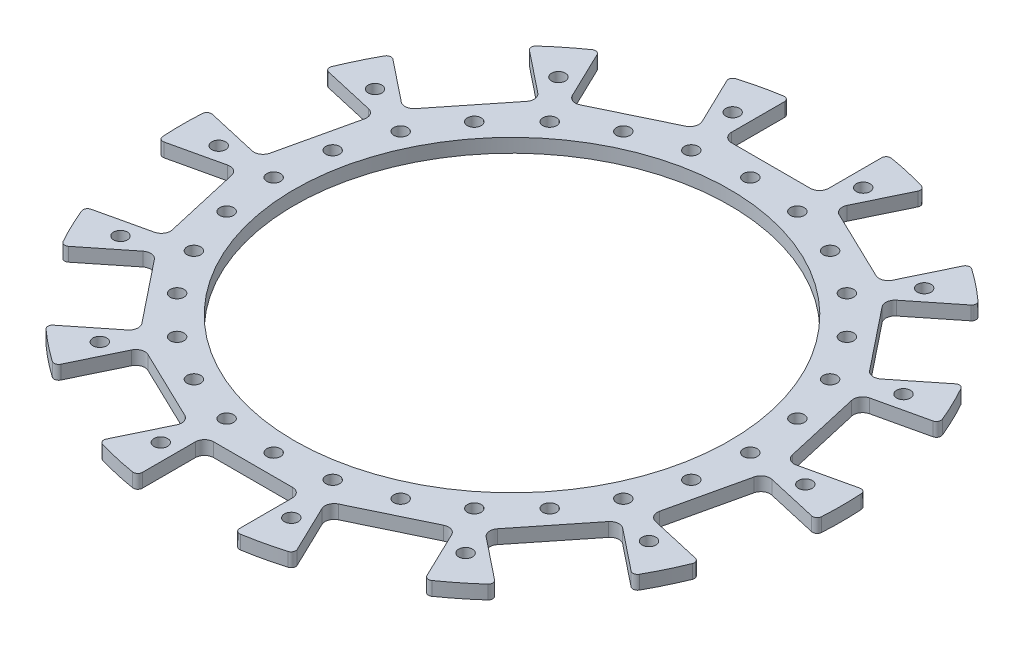
from build123d import *

# Parameters (mm, degrees)
EXTRUDE_1_DEPTH     = 3
FILLET_1_R          = 2
FILLET_2_R          = 1
SKETCH_2_R          = 1.5
CUT_EXTRUDE_1_DEPTH = 11
SKETCH_3_R          = 52.5
SKETCH_3_R_2        = 28
SKETCH_3_R_3        = 9
CUT_EXTRUDE_2_DEPTH = 11
EXTRUDE_START       = -3
SKETCH_9_R          = 52.5
SKETCH_9_R_2        = 47.5
EXTRUDE_2_DEPTH     = 3
SKETCH_10_R         = 1.5
CUT_EXTRUDE_3_DEPTH = 3


with BuildPart() as part:
    # 草图1 → 凸台-拉伸1 (new body)
    with BuildSketch(Plane(origin=(0, 0, 0), x_dir=(1, 0, 0), z_dir=(0, 1, 0))):
        with BuildLine():
            Line((-10.6, -71.215447762), (-10.6, -56.5))
            Line((-10.6, -56.5), (10.6, -56.5))
            Line((10.6, -56.5), (10.6, -71.215447762))
            ThreePointArc((10.6, -71.215447762), (16.021507245, -70.194809677), (21.348954758, -68.762068982))
            Line((21.348954758, -68.762068982), (14.96416126, -55.503908671))
            Line((14.96416126, -55.503908671), (34.06470126, -46.305573402))
            Line((34.06470126, -46.305573402), (40.449494758, -59.563733713))
            ThreePointArc((40.449494758, -59.563733713), (44.891265734, -56.291866738), (49.069487199, -52.689519129))
            Line((49.069487199, -52.689519129), (37.56448686, -43.514587519))
            Line((37.56448686, -43.514587519), (50.782470659, -26.939760091))
            Line((50.782470659, -26.939760091), (62.287470998, -36.114691701))
            ThreePointArc((62.287470998, -36.114691701), (64.869758489, -31.239629216), (67.071205902, -26.181163817))
            Line((67.071205902, -26.181163817), (52.724705138, -22.906668638))
            Line((52.724705138, -22.906668638), (57.442148938, -2.238196899))
            Line((57.442148938, -2.238196899), (71.788649702, -5.512692079))
            ThreePointArc((71.788649702, -5.512692079), (72, 0), (71.788649702, 5.512692079))
            Line((71.788649702, 5.512692079), (57.442148938, 2.238196899))
            Line((57.442148938, 2.238196899), (52.724705138, 22.906668638))
            Line((52.724705138, 22.906668638), (67.071205902, 26.181163817))
            ThreePointArc((67.071205902, 26.181163817), (64.869758489, 31.239629216), (62.287470998, 36.114691701))
            Line((62.287470998, 36.114691701), (50.782470659, 26.939760091))
            Line((50.782470659, 26.939760091), (37.56448686, 43.514587519))
            Line((37.56448686, 43.514587519), (49.069487199, 52.689519129))
            ThreePointArc((49.069487199, 52.689519129), (44.891265734, 56.291866738), (40.449494758, 59.563733713))
            Line((40.449494758, 59.563733713), (34.06470126, 46.305573402))
            Line((34.06470126, 46.305573402), (14.96416126, 55.503908671))
            Line((14.96416126, 55.503908671), (21.348954758, 68.762068982))
            ThreePointArc((21.348954758, 68.762068982), (16.021507245, 70.194809677), (10.6, 71.215447762))
            Line((10.6, 71.215447762), (10.6, 56.5))
            Line((10.6, 56.5), (-10.6, 56.5))
            Line((-10.6, 56.5), (-10.6, 71.215447762))
            ThreePointArc((-10.6, 71.215447762), (-16.021507245, 70.194809677), (-21.348954758, 68.762068982))
            Line((-21.348954758, 68.762068982), (-14.96416126, 55.503908671))
            Line((-14.96416126, 55.503908671), (-34.06470126, 46.305573402))
            Line((-34.06470126, 46.305573402), (-40.449494758, 59.563733713))
            ThreePointArc((-40.449494758, 59.563733713), (-44.891265734, 56.291866738), (-49.069487199, 52.689519129))
            Line((-49.069487199, 52.689519129), (-37.56448686, 43.514587519))
            Line((-37.56448686, 43.514587519), (-50.782470659, 26.939760091))
            Line((-50.782470659, 26.939760091), (-62.287470998, 36.114691701))
            ThreePointArc((-62.287470998, 36.114691701), (-64.869758489, 31.239629216), (-67.071205902, 26.181163817))
            Line((-67.071205902, 26.181163817), (-52.724705138, 22.906668638))
            Line((-52.724705138, 22.906668638), (-57.442148938, 2.238196899))
            Line((-57.442148938, 2.238196899), (-71.788649702, 5.512692079))
            ThreePointArc((-71.788649702, 5.512692079), (-72, 0), (-71.788649702, -5.512692079))
            Line((-71.788649702, -5.512692079), (-57.442148938, -2.238196899))
            Line((-57.442148938, -2.238196899), (-52.724705138, -22.906668638))
            Line((-52.724705138, -22.906668638), (-67.071205902, -26.181163817))
            ThreePointArc((-67.071205902, -26.181163817), (-64.869758489, -31.239629216), (-62.287470998, -36.114691701))
            Line((-62.287470998, -36.114691701), (-50.782470659, -26.939760091))
            Line((-50.782470659, -26.939760091), (-37.56448686, -43.514587519))
            Line((-37.56448686, -43.514587519), (-49.069487199, -52.689519129))
            ThreePointArc((-49.069487199, -52.689519129), (-44.891265734, -56.291866738), (-40.449494758, -59.563733713))
            Line((-40.449494758, -59.563733713), (-34.06470126, -46.305573402))
            Line((-34.06470126, -46.305573402), (-14.96416126, -55.503908671))
            Line((-14.96416126, -55.503908671), (-21.348954758, -68.762068982))
            ThreePointArc((-21.348954758, -68.762068982), (-16.021507245, -70.194809677), (-10.6, -71.215447762))
        make_face()
    extrude(amount=EXTRUDE_1_DEPTH)

    # 圆角1
    fillet_1_edges = [part.edges().sort_by_distance(p)[0] for p in [
        (10.6, 1.5, 56.5),
        (-10.6, 1.5, 56.5),
        (-14.96416126, 1.5, 55.503908671),
        (-34.06470126, 1.5, 46.305573402),
        (-37.56448686, 1.5, 43.514587519),
        (-50.782470659, 1.5, 26.939760091),
        (-52.724705138, 1.5, 22.906668638),
        (-57.442148938, 1.5, 2.238196899),
        (-57.442148938, 1.5, -2.238196899),
        (-52.724705138, 1.5, -22.906668638),
        (-50.782470659, 1.5, -26.939760091),
        (-37.56448686, 1.5, -43.514587519),
        (-34.06470126, 1.5, -46.305573402),
        (-14.96416126, 1.5, -55.503908671),
        (-10.6, 1.5, -56.5),
        (10.6, 1.5, -56.5),
        (14.96416126, 1.5, -55.503908671),
        (34.06470126, 1.5, -46.305573402),
        (37.56448686, 1.5, -43.514587519),
        (50.782470659, 1.5, -26.939760091),
        (52.724705138, 1.5, -22.906668638),
        (57.442148938, 1.5, -2.238196899),
        (57.442148938, 1.5, 2.238196899),
        (52.724705138, 1.5, 22.906668638),
        (50.782470659, 1.5, 26.939760091),
        (37.56448686, 1.5, 43.514587519),
        (34.06470126, 1.5, 46.305573402),
        (14.96416126, 1.5, 55.503908671),
    ]]
    fillet(fillet_1_edges, radius=FILLET_1_R)

    # 圆角2
    fillet_2_edges = [part.edges().sort_by_distance(p)[0] for p in [
        (21.348954758, 1.5, 68.762068982),
        (10.6, 1.5, 71.215447762),
        (-10.6, 1.5, 71.215447762),
        (-21.348954758, 1.5, 68.762068982),
        (-40.449494758, 1.5, 59.563733713),
        (-49.069487199, 1.5, 52.689519129),
        (-62.287470998, 1.5, 36.114691701),
        (-67.071205902, 1.5, 26.181163817),
        (-71.788649702, 1.5, 5.512692079),
        (-71.788649702, 1.5, -5.512692079),
        (-67.071205902, 1.5, -26.181163817),
        (-62.287470998, 1.5, -36.114691701),
        (-49.069487199, 1.5, -52.689519129),
        (-40.449494758, 1.5, -59.563733713),
        (-21.348954758, 1.5, -68.762068982),
        (-10.6, 1.5, -71.215447762),
        (10.6, 1.5, -71.215447762),
        (21.348954758, 1.5, -68.762068982),
        (40.449494758, 1.5, -59.563733713),
        (49.069487199, 1.5, -52.689519129),
        (62.287470998, 1.5, -36.114691701),
        (67.071205902, 1.5, -26.181163817),
        (71.788649702, 1.5, -5.512692079),
        (71.788649702, 1.5, 5.512692079),
        (67.071205902, 1.5, 26.181163817),
        (62.287470998, 1.5, 36.114691701),
        (49.069487199, 1.5, 52.689519129),
        (40.449494758, 1.5, 59.563733713),
    ]]
    fillet(fillet_2_edges, radius=FILLET_2_R)

    # 草图2 → 切除-拉伸1 (cut)
    with BuildSketch(Plane(origin=(0, 0, 0), x_dir=(1, 0, 0), z_dir=(0, 1, 0))):
        with Locations(Location((64, 0, 0), (0, 0, 270))):
            Circle(SKETCH_2_R)
        with Locations(Location((57.662007546, -27.768559304, 0), (0, 0, 270))):
            Circle(SKETCH_2_R)
        with Locations(Location((39.903347319, -50.037214878, 0), (0, 0, 270))):
            Circle(SKETCH_2_R)
        with Locations(Location((14.241339773, -62.39538638, 0), (0, 0, 270))):
            Circle(SKETCH_2_R)
        with Locations(Location((-14.241339773, -62.39538638, 0), (0, 0, 270))):
            Circle(SKETCH_2_R)
        with Locations(Location((-39.903347319, -50.037214878, 0), (0, 0, 270))):
            Circle(SKETCH_2_R)
        with Locations(Location((-57.662007546, -27.768559304, 0), (0, 0, 270))):
            Circle(SKETCH_2_R)
        with Locations(Location((-64, 0, 0), (0, 0, 270))):
            Circle(SKETCH_2_R)
        with Locations(Location((-57.662007546, 27.768559304, 0), (0, 0, 270))):
            Circle(SKETCH_2_R)
        with Locations(Location((-39.903347319, 50.037214878, 0), (0, 0, 270))):
            Circle(SKETCH_2_R)
        with Locations(Location((-14.241339773, 62.39538638, 0), (0, 0, 270))):
            Circle(SKETCH_2_R)
        with Locations(Location((14.241339773, 62.39538638, 0), (0, 0, 270))):
            Circle(SKETCH_2_R)
        with Locations(Location((39.903347319, 50.037214878, 0), (0, 0, 270))):
            Circle(SKETCH_2_R)
        with Locations(Location((57.662007546, 27.768559304, 0), (0, 0, 270))):
            Circle(SKETCH_2_R)
    extrude(amount=CUT_EXTRUDE_1_DEPTH, mode=Mode.SUBTRACT)

    # 草图3 → 切除-拉伸2 (cut)
    # profile 1 of 3: a face of its own
    with BuildSketch(Plane(origin=(0, 0, 0), x_dir=(1, 0, 0), z_dir=(0, 1, 0))):
        with Locations(Location((0, 0, 0), (0, 0, 270))):
            Circle(SKETCH_3_R)
        Circle(SKETCH_3_R_2, mode=Mode.SUBTRACT)
    # profile 2 of 3: a face of its own
    with BuildSketch(Plane(origin=(0, 0, 0), x_dir=(1, 0, 0), z_dir=(0, 1, 0))):
        Circle(SKETCH_3_R_2)
        Circle(SKETCH_3_R_3, mode=Mode.SUBTRACT)
    # profile 3 of 3: a face of its own
    with BuildSketch(Plane(origin=(0, 0, 0), x_dir=(1, 0, 0), z_dir=(0, 1, 0))):
        Circle(SKETCH_3_R_3)
    extrude(amount=CUT_EXTRUDE_2_DEPTH, mode=Mode.SUBTRACT)

    # 草图9 → 凸台-拉伸2 (add)
    with BuildSketch(Plane(origin=(0, 3, 0), x_dir=(1, 0, 0), z_dir=(0, 1, 0)).offset(EXTRUDE_START)):
        Circle(SKETCH_9_R)
        with Locations(Location((0, 0, 0), (0, 0, 270))):
            Circle(SKETCH_9_R_2, mode=Mode.SUBTRACT)
    extrude(amount=EXTRUDE_2_DEPTH)

    # 草图10 → 切除-拉伸3 (cut)
    with BuildSketch(Plane(origin=(0, 3, 0), x_dir=(1, 0, 0), z_dir=(0, 1, 0))):
        with Locations(Location((0, 52, 0), (0, 0, 270))):
            Circle(SKETCH_10_R)
        with Locations(Location((11.571088566, 50.696251433, 0), (0, 0, 270))):
            Circle(SKETCH_10_R)
        with Locations(Location((22.561954434, 46.850381131, 0), (0, 0, 270))):
            Circle(SKETCH_10_R)
        with Locations(Location((32.421469697, 40.655237088, 0), (0, 0, 270))):
            Circle(SKETCH_10_R)
        with Locations(Location((40.655237088, 32.421469697, 0), (0, 0, 270))):
            Circle(SKETCH_10_R)
        with Locations(Location((46.850381131, 22.561954434, 0), (0, 0, 270))):
            Circle(SKETCH_10_R)
        with Locations(Location((50.696251433, 11.571088566, 0), (0, 0, 270))):
            Circle(SKETCH_10_R)
        with Locations(Location((52, 0, 0), (0, 0, 270))):
            Circle(SKETCH_10_R)
        with Locations(Location((50.696251433, -11.571088566, 0), (0, 0, 270))):
            Circle(SKETCH_10_R)
        with Locations(Location((46.850381131, -22.561954434, 0), (0, 0, 270))):
            Circle(SKETCH_10_R)
        with Locations(Location((40.655237088, -32.421469697, 0), (0, 0, 270))):
            Circle(SKETCH_10_R)
        with Locations(Location((32.421469697, -40.655237088, 0), (0, 0, 270))):
            Circle(SKETCH_10_R)
        with Locations(Location((22.561954434, -46.850381131, 0), (0, 0, 270))):
            Circle(SKETCH_10_R)
        with Locations(Location((11.571088566, -50.696251433, 0), (0, 0, 270))):
            Circle(SKETCH_10_R)
        with Locations(Location((0, -52, 0), (0, 0, 270))):
            Circle(SKETCH_10_R)
        with Locations(Location((-11.571088566, -50.696251433, 0), (0, 0, 270))):
            Circle(SKETCH_10_R)
        with Locations(Location((-22.561954434, -46.850381131, 0), (0, 0, 270))):
            Circle(SKETCH_10_R)
        with Locations(Location((-32.421469697, -40.655237088, 0), (0, 0, 270))):
            Circle(SKETCH_10_R)
        with Locations(Location((-40.655237088, -32.421469697, 0), (0, 0, 270))):
            Circle(SKETCH_10_R)
        with Locations(Location((-46.850381131, -22.561954434, 0), (0, 0, 270))):
            Circle(SKETCH_10_R)
        with Locations(Location((-50.696251433, -11.571088566, 0), (0, 0, 270))):
            Circle(SKETCH_10_R)
        with Locations(Location((-52, 0, 0), (0, 0, 270))):
            Circle(SKETCH_10_R)
        with Locations(Location((-50.696251433, 11.571088566, 0), (0, 0, 270))):
            Circle(SKETCH_10_R)
        with Locations(Location((-46.850381131, 22.561954434, 0), (0, 0, 270))):
            Circle(SKETCH_10_R)
        with Locations(Location((-40.655237088, 32.421469697, 0), (0, 0, 270))):
            Circle(SKETCH_10_R)
        with Locations(Location((-32.421469697, 40.655237088, 0), (0, 0, 270))):
            Circle(SKETCH_10_R)
        with Locations(Location((-22.561954434, 46.850381131, 0), (0, 0, 270))):
            Circle(SKETCH_10_R)
        with Locations(Location((-11.571088566, 50.696251433, 0), (0, 0, 270))):
            Circle(SKETCH_10_R)
    extrude(amount=-CUT_EXTRUDE_3_DEPTH, mode=Mode.SUBTRACT)


solid = part.part
